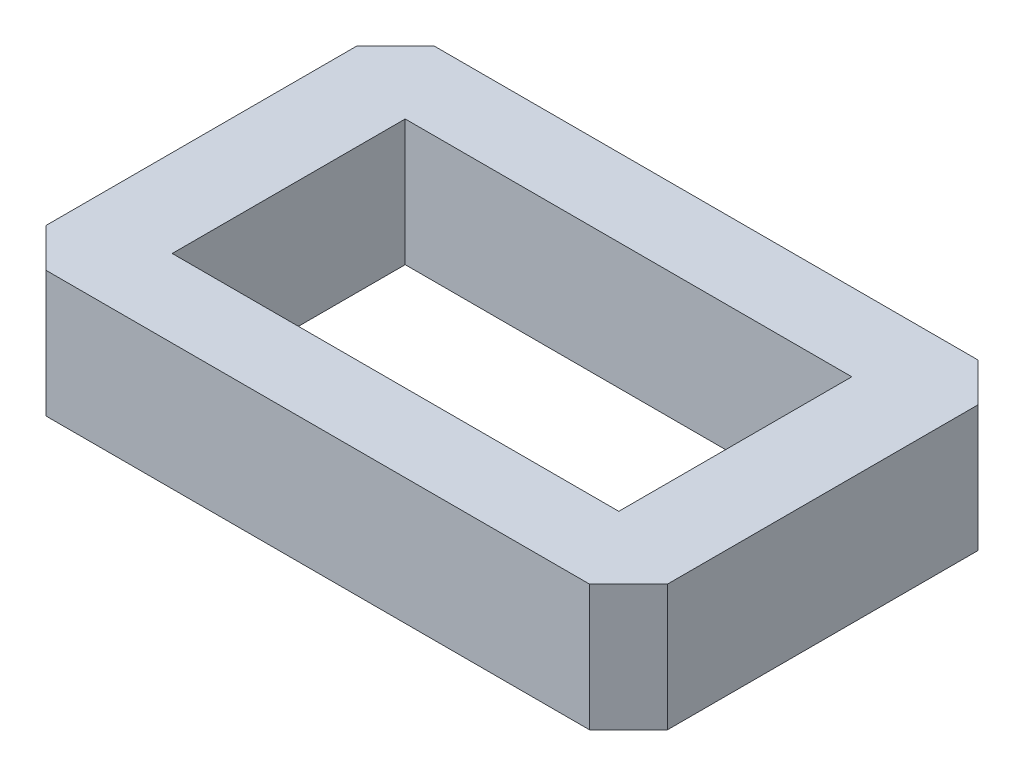
from build123d import *

# Parameters (mm, degrees)
SKETCH2_W           = 32
SKETCH2_H           = 20
BOSS_EXTRUDE1_DEPTH = 6.5
SKETCH3_W           = 23
SKETCH3_H           = 12
CUT_EXTRUDE1_DEPTH  = 39.291643997
CHAMFER1_SIZE       = 2


with BuildPart() as part:
    # Sketch2 → Boss-Extrude1 (new body)
    with BuildSketch(Plane(origin=(0, 0, 0), x_dir=(1, 0, 0), z_dir=(0, 1, 0))):
        with Locations((16, 10)):
            Rectangle(SKETCH2_W, SKETCH2_H)
    extrude(amount=BOSS_EXTRUDE1_DEPTH)

    # Sketch3 → Cut-Extrude1 (cut, through all)
    with BuildSketch(Plane(origin=(0, 6.5, 0), x_dir=(1, 0, 0), z_dir=(0, 1, 0))):
        with Locations((16, 10)):
            Rectangle(SKETCH3_W, SKETCH3_H)
    extrude(amount=-CUT_EXTRUDE1_DEPTH, mode=Mode.SUBTRACT)

    # Chamfer1
    chamfer1_edges = [part.edges().sort_by_distance(p)[0] for p in [
        (0, 3.25, -20),
        (32, 3.25, -20),
        (32, 3.25, 0),
        (0, 3.25, 0),
    ]]
    chamfer(chamfer1_edges, length=CHAMFER1_SIZE)


solid = part.part
